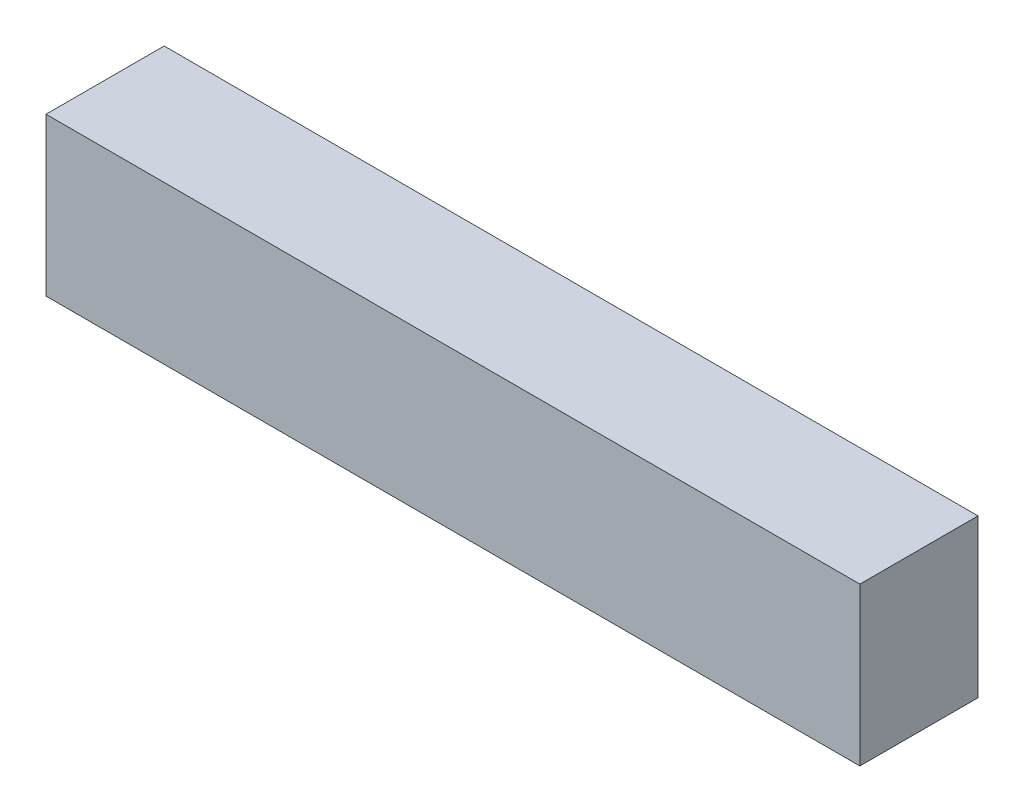
from build123d import *

# Parameters (mm, degrees)
CAR_BODY_DEPTH      = 900
GRILLE_DUCT_START   = 40
SKETCH2_W           = 235
SKETCH2_H           = 350
GRILLE_DUCT_DEPTH   = 410
FLOOR_EXIT_START    = 300
SKETCH3_W           = 235
SKETCH3_H           = 375
FLOOR_EXIT_DEPTH    = 150
RADIATOR_START      = 200
SKETCH4_W           = 225
SKETCH4_H           = 350
RADIATOR_DEPTH      = 25
RADIATOR_TOOL_START = 200
SKETCH5_W           = 225
SKETCH5_H           = 350
RADIATOR_TOOL_DEPTH = 25
FLUID_DOMAIN_START  = -9000
SKETCH6_W           = 4500
SKETCH6_H           = 6000
FLUID_DOMAIN_DEPTH  = 31000


with BuildPart() as part:
    # Sketch1 → car_body (new body)
    with BuildSketch(Plane.XY):
        with BuildLine():
            Line((300, 150), (4400, 150))
            Line((4400, 150), (4400, 1126.953873476))
            Line((4400, 1126.953873476), (3600, 1500))
            Line((3600, 1500), (300, 1500))
            ThreePointArc((300, 1500), (87.867965644, 1412.132034356), (0, 1200))
            Line((0, 1200), (0, 450))
            ThreePointArc((0, 450), (87.867965644, 237.867965644), (300, 150))
        make_face()
    extrude(amount=CAR_BODY_DEPTH)


with BuildPart() as body_2:
    # Sketch2 → grille_duct (new body)
    with BuildSketch(Plane(origin=(0, 0, 0), x_dir=(0, 0, -1), z_dir=(1, 0, 0)).offset(GRILLE_DUCT_START)):
        with Locations((-107.5, 645)):
            Rectangle(SKETCH2_W, SKETCH2_H)
    extrude(amount=GRILLE_DUCT_DEPTH)


with BuildPart() as part_1:
    add(part.part)

    # Combine1: cut body 2
    add(body_2.part, mode=Mode.SUBTRACT)


with BuildPart() as body_2_2:
    # Sketch3 → floor_exit (new body)
    with BuildSketch(Plane(origin=(0, 0, 0), x_dir=(0, 0, -1), z_dir=(1, 0, 0)).offset(FLOOR_EXIT_START)):
        with Locations((-107.5, 287.5)):
            Rectangle(SKETCH3_W, SKETCH3_H)
    extrude(amount=FLOOR_EXIT_DEPTH)


with BuildPart() as part_2:
    add(part_1.part)

    # Combine2: cut body 2 2
    add(body_2_2.part, mode=Mode.SUBTRACT)


with BuildPart() as body_2_3:
    # Sketch4 → radiator (new body)
    with BuildSketch(Plane(origin=(0, 0, 0), x_dir=(0, 0, -1), z_dir=(1, 0, 0)).offset(RADIATOR_START)):
        with Locations((-112.5, 645)):
            Rectangle(SKETCH4_W, SKETCH4_H)
    extrude(amount=RADIATOR_DEPTH)


with BuildPart() as body_3:
    # Sketch5 → radiator_tool (new body)
    with BuildSketch(Plane(origin=(0, 0, 0), x_dir=(0, 0, -1), z_dir=(1, 0, 0)).offset(RADIATOR_TOOL_START)):
        with Locations((-112.5, 645)):
            Rectangle(SKETCH5_W, SKETCH5_H)
    extrude(amount=RADIATOR_TOOL_DEPTH)


with BuildPart() as body_4:
    # Sketch6 → fluid_domain (new body)
    with BuildSketch(Plane(origin=(0, 0, 0), x_dir=(0, 0, -1), z_dir=(1, 0, 0)).offset(FLUID_DOMAIN_START)):
        with Locations((-2250, 3000)):
            Rectangle(SKETCH6_W, SKETCH6_H)
    extrude(amount=FLUID_DOMAIN_DEPTH)

    # Combine3: cut part
    add(part_2.part, mode=Mode.SUBTRACT)

    # Combine4: cut body 3
    add(body_3.part, mode=Mode.SUBTRACT)


solid = Compound([body_2_3.part, body_4.part])
